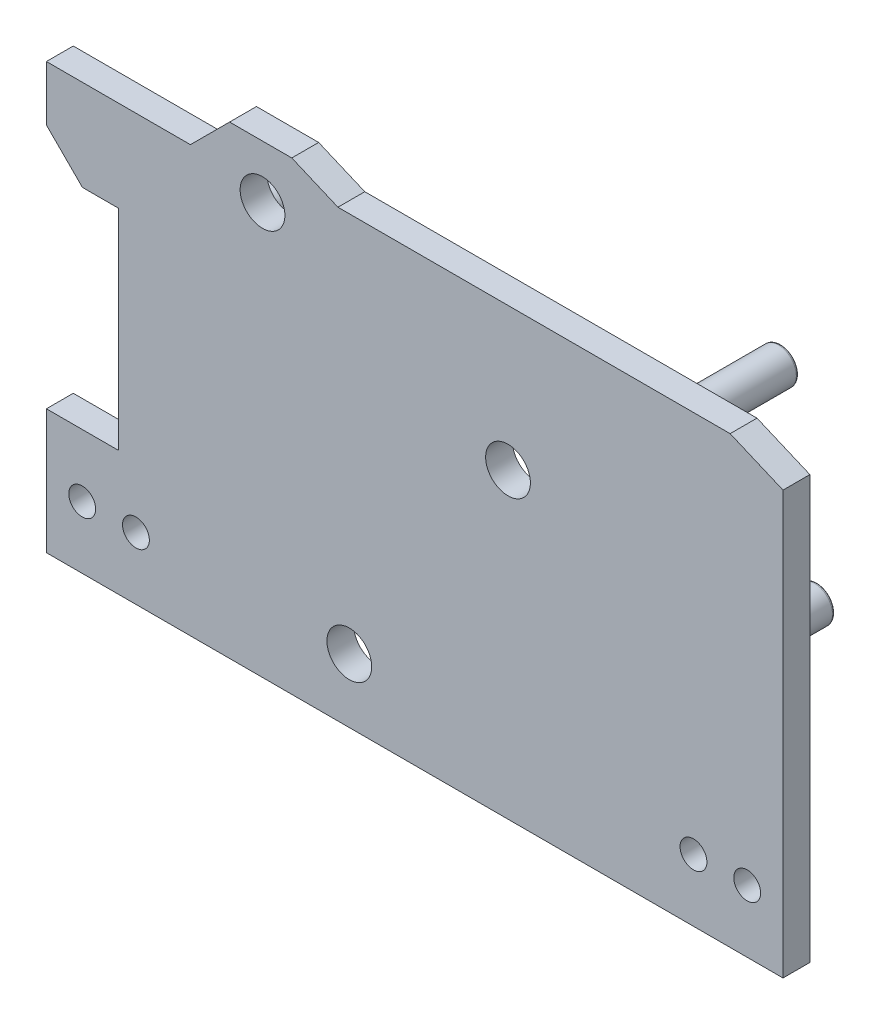
from build123d import *

# Parameters (mm, degrees)
SKETCH_2_R          = 2.5
EXTRUDE_11_DEPTH    = 3
SKETCH_2_16_R       = 2
SKETCH_2_16_R_2     = 4
EXTRUDE_12_DEPTH    = 0.5
SKETCH_2_17_R       = 2
EXTRUDE_13_DEPTH    = 12.5
FILLET_1_R          = 0.3
CUT_EXTRUDE_1_REACH = 52.966
SKETCH_3_R          = 1.5


with BuildPart() as part:
    # 스케치2 → 보스-돌출11 (new body)
    with BuildSketch(Plane.XY):
        Polygon((-25.900833035, 21.467672234), (-41.985987982, 21.467672234), (-41.985987982, 15.322651266), (-37.964699246, 11.301362529), (-33.943410509, 11.301362529), (-33.943410509, -12.123358681), (-41.985987982, -12.123358681), (-41.985987982, -26.048068749), (40.290588771, -26.048068749), (40.290588771, 21.148605879), (34.384238258, 23.655411353), (-9.421808725, 23.655411353), (-14.576398582, 25.843150472), (-21.525354797, 25.843150472), align=None)
        with Locations((-8.153758739, -18.910029411)):
            Circle(SKETCH_2_R, mode=Mode.SUBTRACT)
        with Locations((-17.847699606, 19.897540861)):
            Circle(SKETCH_2_R, mode=Mode.SUBTRACT)
        with Locations((9.574246485, 7.73050044)):
            Circle(SKETCH_2_R, mode=Mode.SUBTRACT)
    extrude(amount=EXTRUDE_11_DEPTH)

    # 스케치2<16> → 보스-돌출12 (add)
    # profile 1 of 3: a face of its own
    with BuildSketch(Plane.XY):
        with BuildLine():
            ThreePointArc((23.706105599, -5.125632338), (23.939439675, -5.923767386), (24.695702599, -6.26949956))
            Line((24.695702599, -6.26949956), (30.574246485, -6.26949956))
            ThreePointArc((30.574246485, -6.26949956), (31.281353266, -5.976606341), (31.574246485, -5.26949956))
            Line((31.574246485, -5.26949956), (31.574246485, 0.609044326))
            ThreePointArc((31.574246485, 0.609044326), (31.228514311, 1.365307251), (30.430379263, 1.598641326))
            ThreePointArc((30.430379263, 1.598641326), (25.952143977, -0.647397052), (23.706105599, -5.125632338))
        make_face()
        with Locations((28.616748621, -3.312001696)):
            Circle(SKETCH_2_16_R, mode=Mode.SUBTRACT)
    # profile 2 of 3: a face of its own
    with BuildSketch(Plane.XY):
        with Locations((-29.162107176, 7.874269984)):
            Circle(SKETCH_2_16_R_2)
        with Locations((-29.162107176, 7.874269984)):
            Circle(SKETCH_2_16_R, mode=Mode.SUBTRACT)
    # profile 3 of 3: a face of its own
    with BuildSketch(Plane.XY):
        with Locations((24.574246485, 17.73050044)):
            Circle(SKETCH_2_16_R_2)
        with Locations((24.574246485, 17.73050044)):
            Circle(SKETCH_2_16_R, mode=Mode.SUBTRACT)
    extrude(amount=-EXTRUDE_12_DEPTH)

    # 스케치2<17> → 보스-돌출13 (add)
    with BuildSketch(Plane.XY):
        with Locations((-29.162107176, 7.874269984)):
            Circle(SKETCH_2_17_R)
        with Locations((24.574246485, 17.73050044)):
            Circle(SKETCH_2_17_R)
        with Locations((28.616748621, -3.312001696)):
            Circle(SKETCH_2_17_R)
    extrude(amount=-EXTRUDE_13_DEPTH)

    # 필렛1
    fillet_1_edges = [part.edges().sort_by_distance(p)[0] for p in [
        (26.616748621, -3.312001696, -12.5),
        (22.574246485, 17.73050044, -12.5),
        (-31.162107176, 7.874269984, -12.5),
    ]]
    fillet(fillet_1_edges, radius=FILLET_1_R)

    # 스케치3 → 컷-돌출1 (cut, up to next)
    with BuildSketch(Plane(origin=(0, 0, 0), x_dir=(-1, 0, 0), z_dir=(0, 0, -1)), mode=Mode.PRIVATE) as cut_extrude_1_sk1:
        with Locations((-36.290588771, -19.088068749)):
            Circle(SKETCH_3_R)
    cut_extrude_1_tool1 = extrude(cut_extrude_1_sk1.sketch, amount=-CUT_EXTRUDE_1_REACH, mode=Mode.PRIVATE) & part.part
    # 스케치3 → 컷-돌출1 (cut, up to next)
    with BuildSketch(Plane(origin=(0, 0, 0), x_dir=(-1, 0, 0), z_dir=(0, 0, -1)), mode=Mode.PRIVATE) as cut_extrude_1_sk2:
        with Locations((-30.290588771, -19.088068749)):
            Circle(SKETCH_3_R)
    cut_extrude_1_tool2 = extrude(cut_extrude_1_sk2.sketch, amount=-CUT_EXTRUDE_1_REACH, mode=Mode.PRIVATE) & part.part
    # 스케치3 → 컷-돌출1 (cut, up to next)
    with BuildSketch(Plane(origin=(0, 0, 0), x_dir=(-1, 0, 0), z_dir=(0, 0, -1)), mode=Mode.PRIVATE) as cut_extrude_1_sk3:
        with Locations((31.985987982, -19.088068749)):
            Circle(SKETCH_3_R)
    cut_extrude_1_tool3 = extrude(cut_extrude_1_sk3.sketch, amount=-CUT_EXTRUDE_1_REACH, mode=Mode.PRIVATE) & part.part
    # 스케치3 → 컷-돌출1 (cut, up to next)
    with BuildSketch(Plane(origin=(0, 0, 0), x_dir=(-1, 0, 0), z_dir=(0, 0, -1)), mode=Mode.PRIVATE) as cut_extrude_1_sk4:
        with Locations((37.985987982, -19.088068749)):
            Circle(SKETCH_3_R)
    cut_extrude_1_tool4 = extrude(cut_extrude_1_sk4.sketch, amount=-CUT_EXTRUDE_1_REACH, mode=Mode.PRIVATE) & part.part
    add(cut_extrude_1_tool1.solids().sort_by_distance((36.290589, -19.088069, 0))[0], mode=Mode.SUBTRACT)
    add(cut_extrude_1_tool2.solids().sort_by_distance((30.290589, -19.088069, 0))[0], mode=Mode.SUBTRACT)
    add(cut_extrude_1_tool3.solids().sort_by_distance((-31.985988, -19.088069, 0))[0], mode=Mode.SUBTRACT)
    add(cut_extrude_1_tool4.solids().sort_by_distance((-37.985988, -19.088069, 0))[0], mode=Mode.SUBTRACT)


solid = part.part
